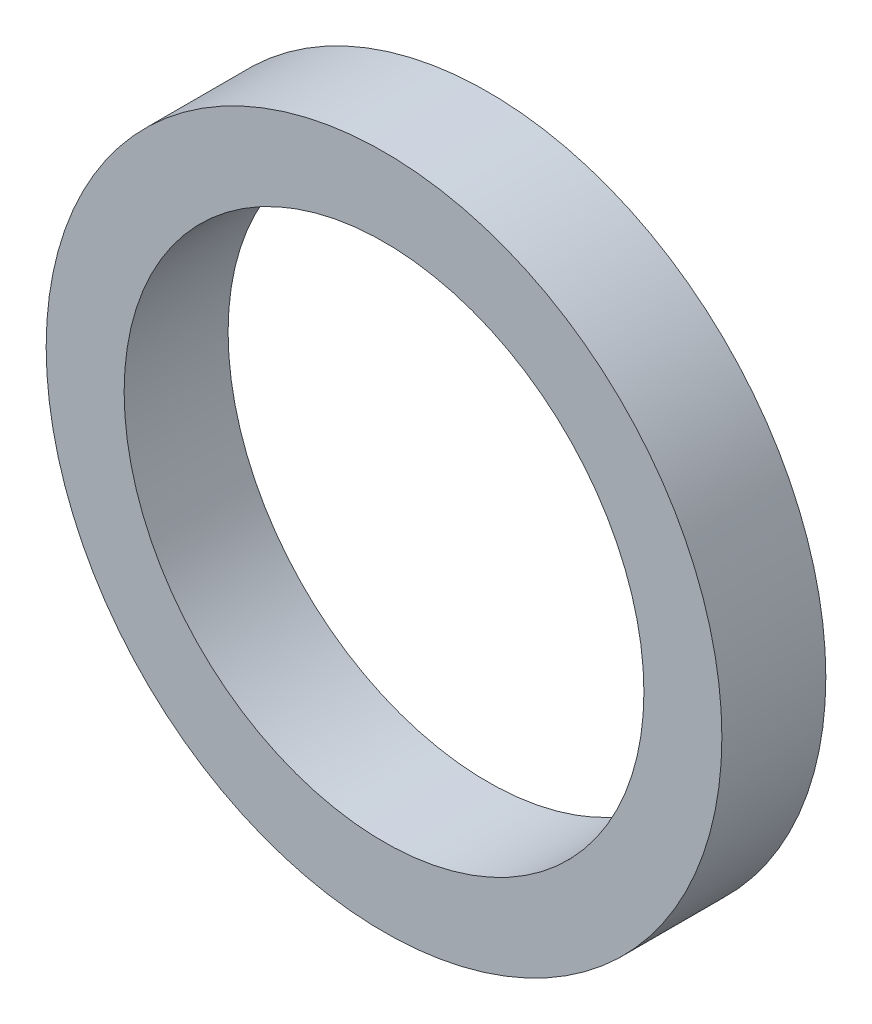
from build123d import *

# Parameters (mm, degrees)
SKETCH1_R           = 13
SKETCH1_R_2         = 10
BOSS_EXTRUDE1_DEPTH = 4


with BuildPart() as part:
    # Sketch1 → Boss-Extrude1 (new body)
    with BuildSketch(Plane.XY):
        Circle(SKETCH1_R)
        Circle(SKETCH1_R_2, mode=Mode.SUBTRACT)
    extrude(amount=BOSS_EXTRUDE1_DEPTH)


solid = part.part
